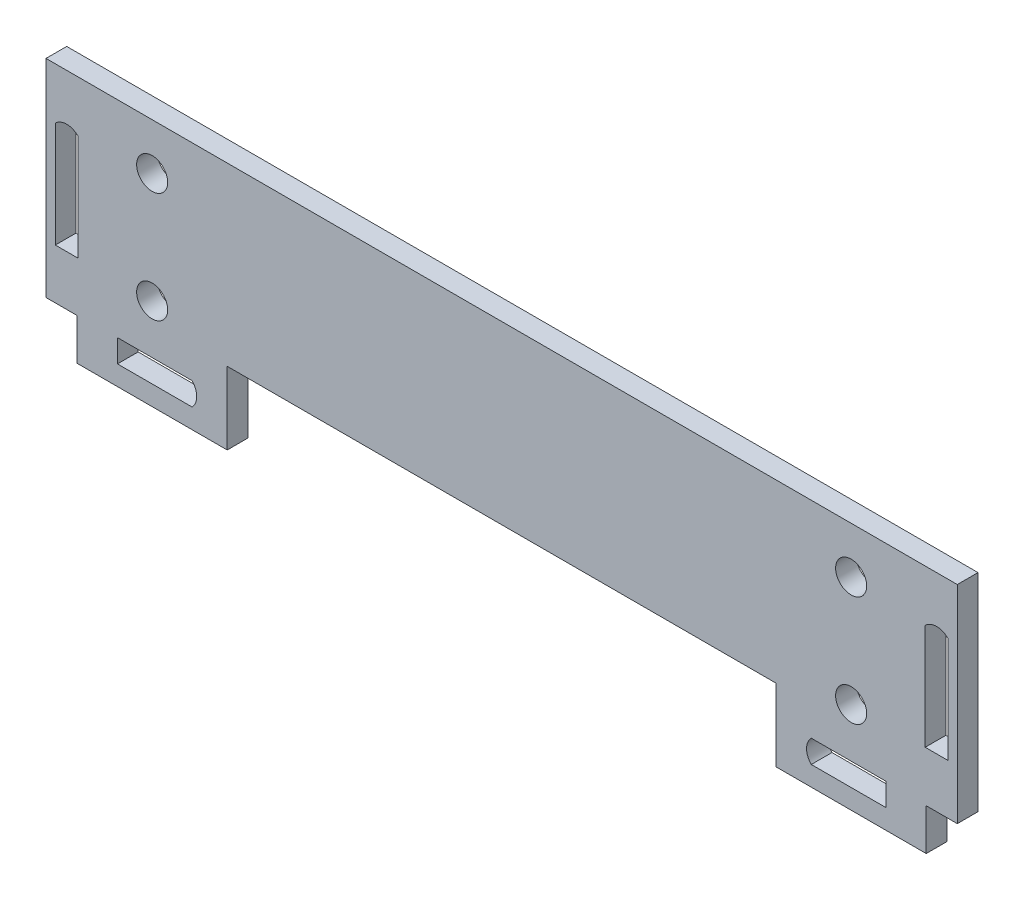
from build123d import *

# Parameters (mm, degrees)
SKETCH_3_R      = 1.5
EXTRUDE_1_DEPTH = 2


with BuildPart() as part:
    # 草图3 → 凸台-拉伸1 (new body)
    with BuildSketch(Plane.XY):
        Polygon((41, 20.009783315), (-41, 20.009783315), (-44, 20.009783315), (-44, 15.009783315), (-44, 5.009783315), (-44, 0.009783315), (-41, 0.009783315), (-41, -3.990216685), (-26.5, -3.990216685), (-26.5, 3.009783315), (26.5, 3.009783315), (26.5, -3.990216685), (41, -3.990216685), (41, 0.009783315), (44, 0.009783315), (44, 5.009783315), (44, 15.009783315), (44, 20.009783315), align=None)
        with Locations((-33.75, 15.509783315)):
            Circle(SKETCH_3_R, mode=Mode.SUBTRACT)
        with Locations((-33.75, 4.849783315)):
            Circle(SKETCH_3_R, mode=Mode.SUBTRACT)
        with Locations(Location((33.75, 4.849783315, 0), (0, 0, 180))):
            Circle(SKETCH_3_R, mode=Mode.SUBTRACT)
        with Locations(Location((33.75, 15.509783315, 0), (0, 0, 180))):
            Circle(SKETCH_3_R, mode=Mode.SUBTRACT)
        with BuildLine():
            Line((37.1, -2.090216685), (29.9, -2.090216685))
            ThreePointArc((29.9, -2.090216685), (29.444365081, -0.990216685), (29.9, 0.109783315))
            Line((29.9, 0.109783315), (37.1, 0.109783315))
            Line((37.1, 0.109783315), (37.1, -2.090216685))
        make_face(mode=Mode.SUBTRACT)
        with BuildLine():
            Line((-37.1, 0.109783315), (-29.9, 0.109783315))
            ThreePointArc((-29.9, 0.109783315), (-29.444365081, -0.990216685), (-29.9, -2.090216685))
            Line((-29.9, -2.090216685), (-37.1, -2.090216685))
            Line((-37.1, -2.090216685), (-37.1, 0.109783315))
        make_face(mode=Mode.SUBTRACT)
        with BuildLine():
            Line((-43.1, 15.049783315), (-43.1, 4.849783315))
            Line((-43.1, 4.849783315), (-40.9, 4.849783315))
            Line((-40.9, 4.849783315), (-40.9, 15.049783315))
            ThreePointArc((-40.9, 15.049783315), (-42, 15.505418233), (-43.1, 15.049783315))
        make_face(mode=Mode.SUBTRACT)
        with BuildLine():
            Line((40.9, 15.049783315), (40.9, 4.849783315))
            Line((40.9, 4.849783315), (43.1, 4.849783315))
            Line((43.1, 4.849783315), (43.1, 15.049783315))
            ThreePointArc((43.1, 15.049783315), (42, 15.505418233), (40.9, 15.049783315))
        make_face(mode=Mode.SUBTRACT)
    extrude(amount=EXTRUDE_1_DEPTH)


solid = part.part
